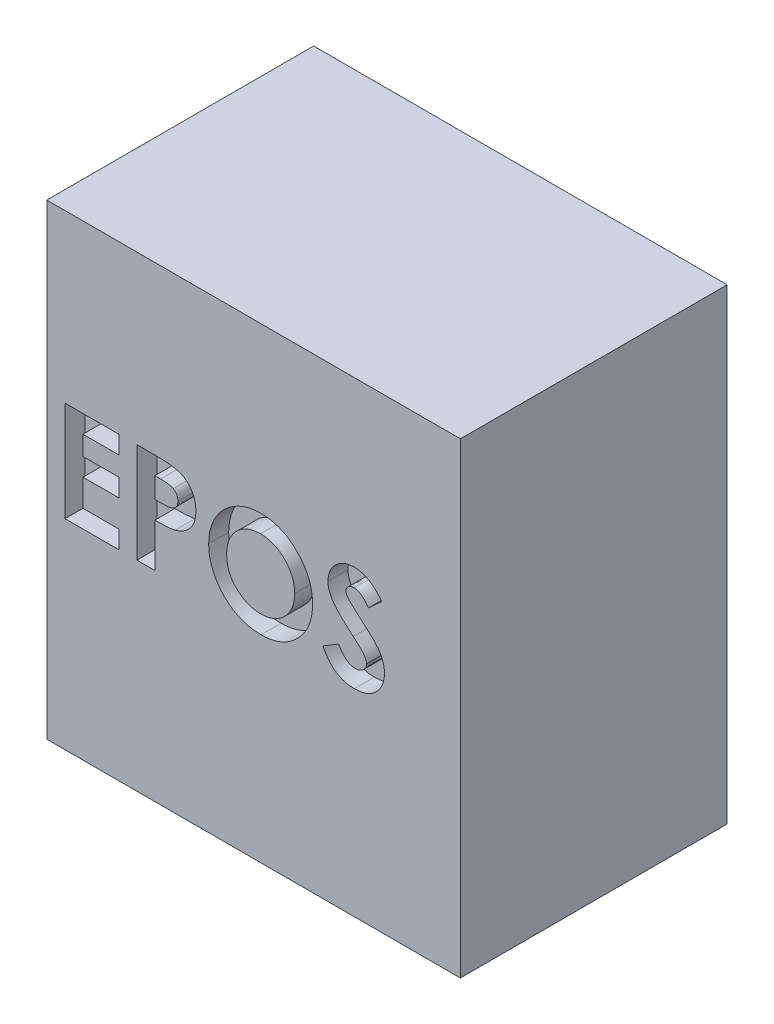
from build123d import *

# Parameters (mm, degrees)
SKETCH_1_W          = 62
SKETCH_1_H          = 70
EXTRUDE_1_DEPTH     = 40
CUT_EXTRUDE_1_DEPTH = 3


with BuildPart() as part:
    # ｽｹｯﾁ1 → ﾎﾞｽ - 押し出し1 (new body)
    with BuildSketch(Plane.XY):
        with Locations((31, 35)):
            Rectangle(SKETCH_1_W, SKETCH_1_H)
    extrude(amount=EXTRUDE_1_DEPTH)

    # ｽｹｯﾁ2 → ｶｯﾄ - 押し出し1 (cut)
    # profile 1 of 4: a face of its own
    with BuildSketch(Plane.XY.offset(40)):
        Polygon((2.730769231, 45), (10.807692308, 45), (10.807692308, 42.307692308), (5.423076923, 42.307692308), (5.423076923, 39.423076923), (10.807692308, 39.423076923), (10.807692308, 36.730769231), (5.423076923, 36.730769231), (5.423076923, 32.692307692), (10.807692308, 32.692307692), (10.807692308, 30), (2.730769231, 30), align=None)
    # profile 2 of 4: a face of its own
    with BuildSketch(Plane.XY.offset(40)):
        with BuildLine():
            Line((13.5, 45), (16.504807692, 45))
            add(Edge.make_bspline(
                [(16.504807692, 45), (16.701137929, 44.999121184), (17.079900108, 44.997425764), (17.626106334, 44.97686654), (18.13000832, 44.940023157), (18.591490297, 44.894490563), (19.010362515, 44.830655638), (19.387149527, 44.757473895), (19.721929525, 44.668317232), (20.018477653, 44.562489509), (20.284620018, 44.437722758), (20.536476535, 44.304837262), (20.768355217, 44.14624311), (20.991959684, 43.979032905), (21.19450608, 43.787233121), (21.388630465, 43.583608313), (21.566111139, 43.360082886), (21.727770484, 43.119362557), (21.874420419, 42.865894808), (22.002543613, 42.599226514), (22.106469973, 42.3189357), (22.193651266, 42.026835529), (22.26367613, 41.722938732), (22.310286909, 41.405376315), (22.341947295, 41.076365621), (22.344740887, 40.852440735), (22.346153846, 40.739182692)],
                knots=[0, 0, 0, 0, 1.698747864, 3.27724071, 4.728299578, 6.070144658, 7.288476769, 8.393259625, 9.389771311, 10.283485332, 11.113357557, 11.931608583, 12.74405601, 13.541433047, 14.344816069, 15.154114104, 15.974336324, 16.810834471, 17.661136416, 18.50621059, 19.367396281, 20.244825668, 21.142564693, 22.063065223, 23.020325768, 24, 24, 24, 24], degree=3))
            add(Edge.make_bspline(
                [(22.346153846, 40.739182692), (22.344109471, 40.613888017), (22.340092023, 40.367668583), (22.300708081, 40.0067411), (22.233427866, 39.662629423), (22.145496144, 39.332431596), (22.022881611, 39.021580106), (21.882800266, 38.722657941), (21.710455778, 38.444045961), (21.513524648, 38.182259065), (21.298453388, 37.935168802), (21.060136215, 37.709909436), (20.803115557, 37.504945383), (20.528879213, 37.318128602), (20.236397619, 37.149835946), (19.925881815, 36.998491531), (19.595211422, 36.868935822), (19.36494251, 36.801179235), (19.248197115, 36.766826923)],
                knots=[0, 0, 0, 0, 1.102006807, 2.165578795, 3.188629044, 4.184801286, 5.166646146, 6.124351954, 7.085497154, 8.042432466, 9.003981491, 9.963833307, 10.922997304, 11.89326795, 12.880200226, 13.889073926, 14.929769137, 16, 16, 16, 16], degree=3))
            add(Edge.make_bspline(
                [(19.248197115, 36.766826923), (19.171301883, 36.747695265), (19.004722048, 36.706249932), (18.729078174, 36.664172517), (18.411427551, 36.625484921), (18.050743006, 36.592237616), (17.646816596, 36.569637195), (17.200039427, 36.551987272), (16.710209027, 36.539153955), (16.369600337, 36.538698573), (16.192307692, 36.538461538)],
                knots=[0, 0, 0, 0, 0.618981996, 1.340914327, 2.176866532, 3.120127938, 4.170906482, 5.338178032, 6.614476169, 8, 8, 8, 8], degree=3))
            Line((16.192307692, 36.538461538), (16.192307692, 30))
            Line((16.192307692, 30), (13.5, 30))
            Line((13.5, 30), (13.5, 45))
        make_face()
        with BuildLine():
            Line((16.192307692, 39.230769231), (17.144831731, 39.230769231))
            add(Edge.make_bspline(
                [(17.144831731, 39.230769231), (17.318158518, 39.231868257), (17.637082381, 39.233890482), (18.072619755, 39.263133028), (18.422625967, 39.307792304), (18.699137374, 39.371844033), (18.91746932, 39.469051012), (19.105766955, 39.581501183), (19.267274643, 39.723691337), (19.407116529, 39.886167917), (19.518915903, 40.072861651), (19.596442946, 40.280732594), (19.646802989, 40.505413154), (19.651454206, 40.661775953), (19.653846154, 40.7421875)],
                knots=[0, 0, 0, 0, 1.8619151, 3.425951444, 4.686033666, 5.651700536, 6.461346321, 7.243864085, 7.999046032, 8.762387399, 9.539336099, 10.322741239, 11.137448474, 12, 12, 12, 12], degree=3))
            add(Edge.make_bspline(
                [(19.653846154, 40.7421875), (19.651478811, 40.812442021), (19.646885596, 40.948752683), (19.61314259, 41.145482779), (19.559365945, 41.328875813), (19.481445654, 41.497016485), (19.380713168, 41.6496191), (19.257899883, 41.786623541), (19.114581734, 41.910963874), (19.003931743, 41.976779111), (18.947716346, 42.010216346)],
                knots=[0, 0, 0, 0, 1.102301479, 2.1387299, 3.123554645, 4.094223062, 5.036071848, 5.982632524, 6.975082478, 8, 8, 8, 8], degree=3))
            add(Edge.make_bspline(
                [(18.947716346, 42.010216346), (18.90009866, 42.034297976), (18.79928226, 42.08528372), (18.627582156, 42.144558376), (18.429442859, 42.194563078), (18.203526704, 42.236066497), (17.950734936, 42.268277461), (17.671112657, 42.292910791), (17.364248376, 42.302816812), (17.15084263, 42.306022318), (17.039663462, 42.307692308)],
                knots=[0, 0, 0, 0, 0.656809284, 1.390599849, 2.23162475, 3.173112763, 4.218524733, 5.370385145, 6.63003504, 8, 8, 8, 8], degree=3))
            Line((17.039663462, 42.307692308), (16.192307692, 42.307692308))
            Line((16.192307692, 42.307692308), (16.192307692, 39.230769231))
        make_face(mode=Mode.SUBTRACT)
    # profile 3 of 4: a face of its own
    with BuildSketch(Plane.XY.offset(40)):
        with BuildLine():
            add(Edge.make_bspline(
                [(32.087740385, 45.384615385), (32.348533768, 45.377862977), (32.863398976, 45.364532195), (33.6205799, 45.253409721), (34.350263723, 45.07235158), (35.052120484, 44.820667669), (35.724392814, 44.491541107), (36.369452042, 44.09430285), (36.984987597, 43.621455262), (37.564691964, 43.084029099), (38.100443351, 42.499601612), (38.564672241, 41.87036152), (38.960549608, 41.212613065), (39.288653828, 40.524593791), (39.538566263, 39.801538837), (39.713940155, 39.047134826), (39.826609192, 38.261596381), (39.839567865, 37.72675177), (39.846153846, 37.454927885)],
                knots=[0, 0, 0, 0, 1.014329547, 2.002516266, 2.970391464, 3.935626869, 4.897733899, 5.877609409, 6.878433252, 7.912639331, 8.949961323, 9.958554974, 10.949718813, 11.932905612, 12.9188844, 13.919928257, 14.942845884, 16, 16, 16, 16], degree=3))
            add(Edge.make_bspline(
                [(39.846153846, 37.454927885), (39.839140061, 37.186166827), (39.825319171, 36.65656454), (39.718539798, 35.87826514), (39.540212588, 35.131942369), (39.294538864, 34.415906906), (38.972385214, 33.733626983), (38.584227887, 33.080746336), (38.11982415, 32.463323855), (37.59611263, 31.881690872), (37.019551697, 31.353734135), (36.40888214, 30.888473173), (35.766923656, 30.494228591), (35.094615866, 30.171180972), (34.390517038, 29.920475613), (33.656366382, 29.743584765), (32.892209328, 29.636084625), (32.372545474, 29.622354012), (32.108774038, 29.615384615)],
                knots=[0, 0, 0, 0, 1.051557043, 2.072126891, 3.067553643, 4.050577992, 5.02905126, 6.015227836, 7.017913613, 8.04756643, 9.074058332, 10.072836633, 11.047628519, 12.017157415, 12.98668631, 13.966869689, 14.968021931, 16, 16, 16, 16], degree=3))
            add(Edge.make_bspline(
                [(32.108774038, 29.615384615), (31.832900744, 29.621636508), (31.29084743, 29.633920621), (30.497549978, 29.750736932), (29.737502473, 29.926703104), (29.01708975, 30.189323176), (28.328975023, 30.517620349), (27.678214071, 30.921937999), (27.065025595, 31.401607962), (26.492926942, 31.944345711), (25.974604177, 32.538219848), (25.517082668, 33.165595211), (25.131153126, 33.821679201), (24.81680143, 34.506778882), (24.568979181, 35.216636524), (24.394168741, 35.955575367), (24.290904044, 36.721823166), (24.276519871, 37.242273988), (24.269230769, 37.506009615)],
                knots=[0, 0, 0, 0, 1.067978421, 2.098431617, 3.099715153, 4.085208694, 5.062210972, 6.048429807, 7.046490867, 8.072918869, 9.098532598, 10.095778865, 11.076610158, 12.041847152, 13.011192615, 13.984257998, 14.978533688, 16, 16, 16, 16], degree=3))
            add(Edge.make_bspline(
                [(24.269230769, 37.506009615), (24.271518509, 37.683437139), (24.276065021, 38.036045547), (24.330832546, 38.558593208), (24.409682035, 39.070941441), (24.526296688, 39.571047505), (24.667953687, 40.062439416), (24.851490338, 40.540543176), (25.060404718, 41.01046625), (25.304501499, 41.466658255), (25.575913519, 41.904921846), (25.872048197, 42.323189655), (26.193650159, 42.716404215), (26.539683421, 43.087149568), (26.911340458, 43.432988779), (27.303732507, 43.758817683), (27.724469688, 44.055981106), (28.164343385, 44.331736372), (28.62087369, 44.581097077), (29.092202113, 44.793345451), (29.568618355, 44.978698341), (30.056486695, 45.124987037), (30.550578757, 45.24413765), (31.056172913, 45.322933994), (31.568701407, 45.377700002), (31.914316798, 45.382304787), (32.087740385, 45.384615385)],
                knots=[0, 0, 0, 0, 1.034744296, 2.056386356, 3.06226378, 4.057406941, 5.050368692, 6.043467995, 7.042652155, 8.049140477, 9.059438543, 10.048523776, 11.036952808, 12.020949711, 13.004946614, 13.997082645, 14.994316842, 16.007702937, 17.024872941, 18.026463647, 19.021641123, 20.005082605, 20.995858141, 21.984425357, 22.988620895, 24, 24, 24, 24], degree=3))
        make_face()
        with BuildLine():
            add(Edge.make_bspline(
                [(32.045673077, 42.692307692), (31.870159164, 42.68759826), (31.523764935, 42.678303725), (31.015667685, 42.60749194), (30.527876382, 42.494397471), (30.063095045, 42.330581514), (29.619309271, 42.122085378), (29.195732367, 41.869637573), (28.798229997, 41.564560488), (28.42150185, 41.223232352), (28.081189961, 40.842914366), (27.780513671, 40.435338965), (27.528896046, 40.001186792), (27.318164709, 39.544491018), (27.159530716, 39.06011622), (27.04654048, 38.551856559), (26.975134868, 38.018836278), (26.966134102, 37.655477047), (26.961538462, 37.469951923)],
                knots=[0, 0, 0, 0, 1.033739768, 2.040188636, 3.016340934, 3.979330865, 4.937572243, 5.900995986, 6.878200029, 7.884839167, 8.891893314, 9.879764717, 10.863503415, 11.843163062, 12.837761627, 13.859916423, 14.907309254, 16, 16, 16, 16], degree=3))
            add(Edge.make_bspline(
                [(26.961538462, 37.469951923), (26.967631579, 37.264348353), (26.979573079, 36.861399422), (27.063594924, 36.273588379), (27.207347939, 35.718459188), (27.414924497, 35.198726905), (27.672373887, 34.708620291), (27.992085169, 34.254146299), (28.368880536, 33.832583752), (28.659160633, 33.586457977), (28.806490385, 33.461538462)],
                knots=[0, 0, 0, 0, 1.078454662, 2.113592447, 3.107694534, 4.079536787, 5.043276885, 6.005368276, 6.987637804, 8, 8, 8, 8], degree=3))
            add(Edge.make_bspline(
                [(28.806490385, 33.461538462), (28.927181578, 33.369252721), (29.165844773, 33.186760453), (29.546803192, 32.952859175), (29.939115349, 32.752382447), (30.345741732, 32.590399622), (30.765823567, 32.462986654), (31.199303246, 32.373761448), (31.645566567, 32.317764915), (31.947350739, 32.311072269), (32.099759615, 32.307692308)],
                knots=[0, 0, 0, 0, 1.023928204, 2.024787132, 3.009472467, 3.9914905, 4.972207045, 5.96565515, 6.972602802, 8, 8, 8, 8], degree=3))
            add(Edge.make_bspline(
                [(32.099759615, 32.307692308), (32.272255562, 32.312441671), (32.611646762, 32.321786192), (33.110285507, 32.391726245), (33.58799657, 32.510090067), (34.047745621, 32.672468972), (34.48820695, 32.883582958), (34.907227902, 33.143860902), (35.305543134, 33.450106926), (35.681791334, 33.795917448), (36.025699975, 34.177733624), (36.325748815, 34.58748299), (36.585366624, 35.016137543), (36.7917158, 35.469764237), (36.956617063, 35.944081048), (37.068247403, 36.441188624), (37.14025623, 36.959037699), (37.149259532, 37.311452294), (37.153846154, 37.490985577)],
                knots=[0, 0, 0, 0, 1.026359118, 2.019393844, 2.989460624, 3.950973911, 4.916101784, 5.890408035, 6.881132271, 7.902007068, 8.92769091, 9.933912415, 10.920395702, 11.90457117, 12.894218921, 13.903490204, 14.931958862, 16, 16, 16, 16], degree=3))
            add(Edge.make_bspline(
                [(37.153846154, 37.490985577), (37.149100835, 37.669486494), (37.139760397, 38.020838325), (37.069697246, 38.537356013), (36.952084057, 39.032269005), (36.789217545, 39.506385546), (36.581245633, 39.960170446), (36.324067267, 40.392027929), (36.018584852, 40.801540495), (35.671829047, 41.185917472), (35.294406666, 41.539135292), (34.889206029, 41.845664151), (34.467565103, 42.112027984), (34.01980939, 42.320686655), (33.555099595, 42.486924576), (33.070600036, 42.609344566), (32.56447564, 42.677806269), (32.220148748, 42.687430797), (32.045673077, 42.692307692)],
                knots=[0, 0, 0, 0, 1.055025985, 2.07665775, 3.074803781, 4.057872707, 5.035505728, 6.020516407, 7.023567878, 8.050795229, 9.077271434, 10.074415901, 11.050397877, 12.019801805, 12.988065821, 13.964604439, 14.968634123, 16, 16, 16, 16], degree=3))
        make_face(mode=Mode.SUBTRACT)
    # profile 4 of 4: a face of its own
    with BuildSketch(Plane.XY.offset(40)):
        with BuildLine():
            Line((50.230769231, 42.995793269), (48.217548077, 41.153846154))
            add(Edge.make_bspline(
                [(48.217548077, 41.153846154), (48.131310315, 41.275493482), (47.965745839, 41.509039388), (47.697383092, 41.821762861), (47.43023214, 42.088539256), (47.161817993, 42.308254104), (46.889761528, 42.479572475), (46.614534998, 42.600867774), (46.337698737, 42.677976347), (46.151707504, 42.687578219), (46.060096154, 42.692307692)],
                knots=[0, 0, 0, 0, 1.299362458, 2.494594718, 3.587462134, 4.587049575, 5.512617175, 6.380583204, 7.202344345, 8, 8, 8, 8], degree=3))
            add(Edge.make_bspline(
                [(46.060096154, 42.692307692), (45.974643714, 42.689310881), (45.809657504, 42.683524827), (45.574457422, 42.626011874), (45.365643439, 42.526752964), (45.183419349, 42.396963589), (45.039070985, 42.240597482), (44.923820011, 42.076609641), (44.858924027, 41.895604151), (44.850382439, 41.771282278), (44.846153846, 41.709735577)],
                knots=[0, 0, 0, 0, 1.185010067, 2.2879431, 3.333075148, 4.379039566, 5.372662701, 6.27520591, 7.14612461, 8, 8, 8, 8], degree=3))
            add(Edge.make_bspline(
                [(44.846153846, 41.709735577), (44.848803691, 41.647301345), (44.85414011, 41.521567477), (44.905682655, 41.337288835), (44.983371988, 41.157227151), (45.057607317, 41.047615035), (45.095552885, 40.991586538)],
                knots=[0, 0, 0, 0, 0.967525499, 1.948461899, 2.951351359, 4, 4, 4, 4], degree=3))
            add(Edge.make_bspline(
                [(45.095552885, 40.991586538), (45.13004951, 40.948036174), (45.209456186, 40.847788987), (45.360868454, 40.689013069), (45.551010463, 40.494498672), (45.787199278, 40.270934576), (46.059630052, 40.010280541), (46.380930304, 39.722782977), (46.74185161, 39.399538418), (46.998386112, 39.174442612), (47.1328125, 39.056490385)],
                knots=[0, 0, 0, 0, 0.473873513, 1.090794244, 1.870441696, 2.795289791, 3.865433203, 5.087734844, 6.473946851, 8, 8, 8, 8], degree=3))
            add(Edge.make_bspline(
                [(47.1328125, 39.056490385), (47.258991002, 38.947289256), (47.498451584, 38.7400482), (47.83915644, 38.445902796), (48.138579265, 38.181267349), (48.401081966, 37.950113469), (48.622685257, 37.750015825), (48.804320761, 37.58001795), (48.948206846, 37.443429391), (49.029997661, 37.360929819), (49.064903846, 37.325721154)],
                knots=[0, 0, 0, 0, 1.543621617, 2.929473131, 4.163658386, 5.240097082, 6.164993805, 6.925417477, 7.541396219, 8, 8, 8, 8], degree=3))
            add(Edge.make_bspline(
                [(49.064903846, 37.325721154), (49.197330637, 37.182407005), (49.451901435, 36.906906881), (49.78275373, 36.479968331), (50.05505587, 36.063189252), (50.26571397, 35.648727269), (50.42481144, 35.230602521), (50.536977264, 34.798560521), (50.604154122, 34.348086701), (50.611612321, 34.040693311), (50.615384615, 33.885216346)],
                knots=[0, 0, 0, 0, 1.206664779, 2.319633467, 3.337109185, 4.282041471, 5.190008762, 6.099243693, 7.03861361, 8, 8, 8, 8], degree=3))
            add(Edge.make_bspline(
                [(50.615384615, 33.885216346), (50.612699593, 33.733723111), (50.607431479, 33.436487747), (50.542907189, 33.001528065), (50.450899339, 32.585252772), (50.308639061, 32.192191532), (50.135253078, 31.815892364), (49.917888705, 31.462216812), (49.662624054, 31.127585536), (49.370051571, 30.817980479), (49.046431662, 30.537035349), (48.699318555, 30.286931358), (48.325318, 30.080438656), (47.927625402, 29.910406645), (47.506453634, 29.779445717), (47.06230444, 29.682653385), (46.594498464, 29.624560154), (46.274605997, 29.618487196), (46.111177885, 29.615384615)],
                knots=[0, 0, 0, 0, 1.043214005, 2.046824704, 3.02475056, 3.976699089, 4.921714032, 5.875962561, 6.831408892, 7.817874052, 8.806269674, 9.781291748, 10.760897367, 11.74438705, 12.757449933, 13.795994037, 14.874007457, 16, 16, 16, 16], degree=3))
            add(Edge.make_bspline(
                [(46.111177885, 29.615384615), (45.982888208, 29.61766056), (45.728801075, 29.622168235), (45.354315055, 29.658969649), (44.992706469, 29.718363217), (44.644382637, 29.803491941), (44.307774299, 29.911361581), (43.98286763, 30.043120213), (43.67190557, 30.200810049), (43.372535232, 30.381188356), (43.086211925, 30.590631331), (42.809315204, 30.824856981), (42.54459547, 31.0874678), (42.290781327, 31.377842725), (42.04949675, 31.696804028), (41.812843627, 32.039909581), (41.591339537, 32.413526959), (41.454506608, 32.675622571), (41.384615385, 32.809495192)],
                knots=[0, 0, 0, 0, 1.016823716, 2.013894106, 2.979844003, 3.91962641, 4.853723003, 5.779685073, 6.695824784, 7.614987388, 8.547259901, 9.504950863, 10.487499108, 11.500346958, 12.559593716, 13.656357062, 14.802919212, 16, 16, 16, 16], degree=3))
            Line((41.384615385, 32.809495192), (43.752403846, 34.230769231))
            add(Edge.make_bspline(
                [(43.752403846, 34.230769231), (43.83982732, 34.078806315), (44.007425592, 33.787480416), (44.291436532, 33.396047149), (44.58239124, 33.06084935), (44.887016329, 32.787811661), (45.201607673, 32.573283218), (45.527684819, 32.419966309), (45.865476864, 32.325063316), (46.09556546, 32.313473469), (46.210336538, 32.307692308)],
                knots=[0, 0, 0, 0, 1.283663364, 2.460892379, 3.537111102, 4.529833553, 5.449777664, 6.316464042, 7.160231139, 8, 8, 8, 8], degree=3))
            add(Edge.make_bspline(
                [(46.210336538, 32.307692308), (46.327075157, 32.312413517), (46.553565078, 32.321573352), (46.876850459, 32.406179983), (47.173250736, 32.539018599), (47.429456947, 32.728560988), (47.646396212, 32.947321712), (47.806509843, 33.19070302), (47.907094305, 33.45403572), (47.917728522, 33.636963936), (47.923076923, 33.728966346)],
                knots=[0, 0, 0, 0, 1.13588714, 2.203786484, 3.234766741, 4.283437687, 5.291419208, 6.222934724, 7.106237994, 8, 8, 8, 8], degree=3))
            add(Edge.make_bspline(
                [(47.923076923, 33.728966346), (47.918137893, 33.814559617), (47.908104727, 33.988434154), (47.834203516, 34.24695763), (47.718673383, 34.505363535), (47.581993088, 34.71731505), (47.442903774, 34.894776308), (47.309903018, 35.04853846), (47.14794328, 35.218418719), (46.957435218, 35.404630782), (46.740895942, 35.608813921), (46.498143044, 35.83094814), (46.226396748, 36.069076705), (46.034325929, 36.23128753), (45.933894231, 36.316105769)],
                knots=[0, 0, 0, 0, 0.916159276, 1.861089862, 2.860218735, 3.940849679, 4.552606315, 5.27541173, 6.11797699, 7.06649574, 8.129236253, 9.306560635, 10.591630461, 12, 12, 12, 12], degree=3))
            add(Edge.make_bspline(
                [(45.933894231, 36.316105769), (45.742969575, 36.477646336), (45.376527371, 36.787691579), (44.858698047, 37.245618643), (44.392087459, 37.673593444), (43.980725759, 38.076906685), (43.619371562, 38.448110106), (43.310472116, 38.790218764), (43.057420822, 39.105871558), (42.791138899, 39.47974117), (42.538117833, 39.93532698), (42.31943583, 40.483449525), (42.177564177, 41.031502521), (42.161669431, 41.399435116), (42.153846154, 41.580528846)],
                knots=[0, 0, 0, 0, 1.345494975, 2.582412109, 3.71882943, 4.751509156, 5.681369928, 6.505683931, 7.230279997, 7.856715994, 8.973648664, 10.023341002, 11.027102913, 12, 12, 12, 12], degree=3))
            add(Edge.make_bspline(
                [(42.153846154, 41.580528846), (42.157099844, 41.708950799), (42.163509965, 41.961955842), (42.220689225, 42.333962893), (42.306145807, 42.69291844), (42.430253299, 43.037512849), (42.591329837, 43.367314503), (42.786951037, 43.683937919), (43.020154524, 43.984468966), (43.28295911, 44.268708415), (43.572502478, 44.528470924), (43.881916363, 44.757737367), (44.209449454, 44.951379138), (44.553098071, 45.112019049), (44.914991659, 45.234978695), (45.292464167, 45.322138621), (45.686057008, 45.373978566), (45.953770363, 45.381025605), (46.090144231, 45.384615385)],
                knots=[0, 0, 0, 0, 1.010766082, 1.991317756, 2.957454644, 3.913069143, 4.869106762, 5.843196583, 6.838735724, 7.860187025, 8.887984031, 9.89767229, 10.887916223, 11.879572884, 12.879850636, 13.892031539, 14.926195476, 16, 16, 16, 16], degree=3))
            add(Edge.make_bspline(
                [(46.090144231, 45.384615385), (46.266878013, 45.378150086), (46.618950504, 45.365270524), (47.139499836, 45.26455656), (47.647950659, 45.106173242), (48.057669862, 44.915101193), (48.383675783, 44.73000961), (48.633528869, 44.559600595), (48.887767832, 44.36438791), (49.148442953, 44.143756388), (49.410710483, 43.893549041), (49.682027944, 43.619722252), (49.958698302, 43.319909517), (50.138490168, 43.105724689), (50.230769231, 42.995793269)],
                knots=[0, 0, 0, 0, 1.282922637, 2.555718331, 3.837320111, 5.142675274, 5.830281639, 6.55870424, 7.337177975, 8.157850921, 9.037902056, 9.96903443, 10.957596896, 12, 12, 12, 12], degree=3))
        make_face()
    extrude(amount=-CUT_EXTRUDE_1_DEPTH, mode=Mode.SUBTRACT)


solid = part.part
